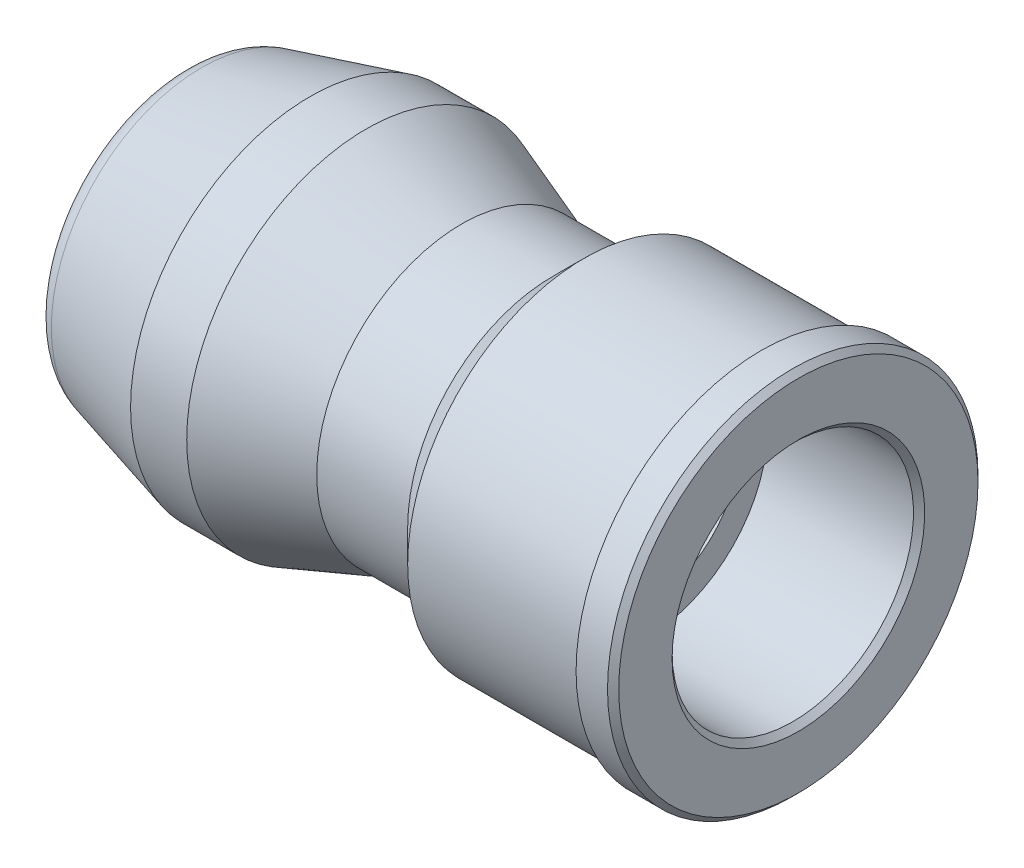
from build123d import *

# Parameters (mm, degrees)
M4_TAPPED_HOLE1_D           = 3.3
M4_TAPPED_HOLE1_CSINK_D     = 4.05
M4_TAPPED_HOLE1_CSINK_ANGLE = 90
FILLET3_R                   = 0.5
CHAMFER1_SIZE               = 0.1


with BuildPart() as part:
    # Sketch2 → Revolve1 (revolve)
    with BuildSketch(Plane.XY, mode=Mode.PRIVATE) as revolve1_sk:
        Polygon((-24.382296362, 0), (-17.415327427, 0), (-16.082296362, 0), (-16.082296362, 2.15), (-13.382296362, 2.15), (-13.382296362, 3.3), (-14.042296362, 3.3), (-14.042296362, 3.15), (-17.192296362, 3.15), (-17.762296362, 2.58), (-19.382296362, 2.58), (-21.082296362, 3.196283143), (-22.082296362, 3.196283143), (-24.382296362, 2.58), align=None)
    revolve(revolve1_sk.sketch.rotate(Axis((-24.382296362, 0, 0), (1, 0, 0)), 90), axis=Axis((-24.382296362, 0, 0), (1, 0, 0)))

    # M4 Tapped Hole1 (through all)
    with Locations(Plane.ZY.offset(24.382296362)):
        with Locations((0, 0)):
            CounterSinkHole(M4_TAPPED_HOLE1_D / 2, M4_TAPPED_HOLE1_CSINK_D / 2, counter_sink_angle=M4_TAPPED_HOLE1_CSINK_ANGLE)

    # Fillet3
    fillet3_edges = [part.edges().sort_by_distance(p)[0] for p in [
        (-24.382296362, 0, -2.58),
    ]]
    fillet(fillet3_edges, radius=FILLET3_R)

    # Chamfer1
    chamfer1_edges = [part.edges().sort_by_distance(p)[0] for p in [
        (-13.382296362, 0, -2.15),
        (-13.382296362, 0, -3.3),
        (-14.042296362, 0, -3.15),
    ]]
    chamfer(chamfer1_edges, length=CHAMFER1_SIZE)


solid = part.part
